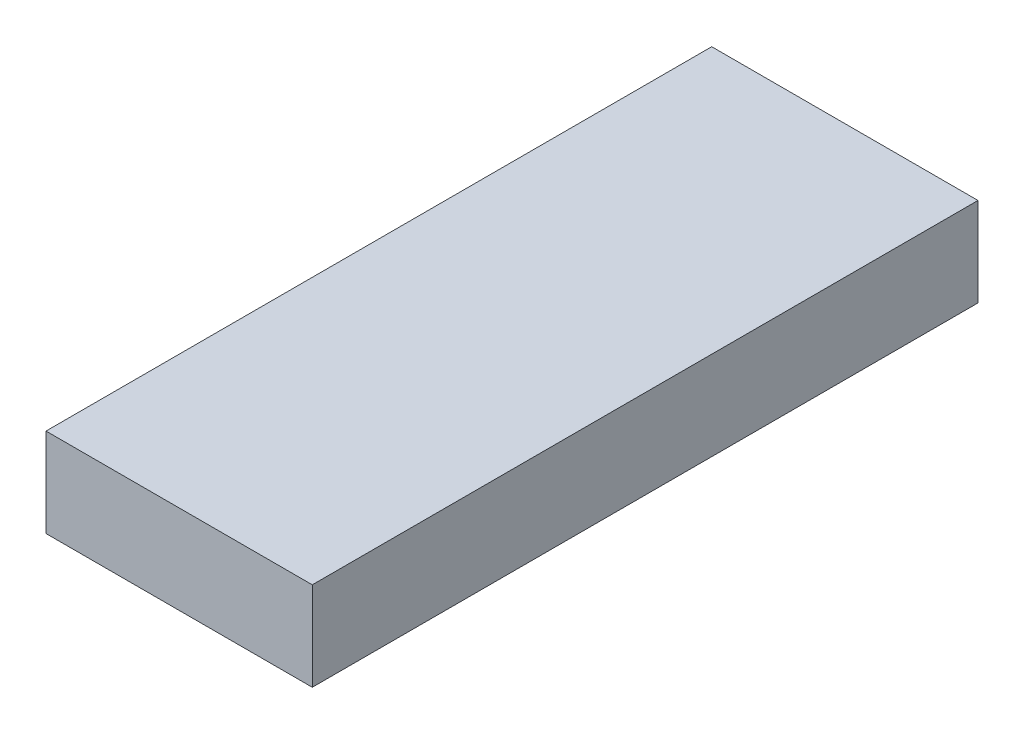
from build123d import *

# Parameters (mm, degrees)
SKETCH_1_W      = 2.6
SKETCH_1_H      = 9.6
EXTRUDE_1_DEPTH = 1.3
EXTRUDE_START   = 1.3
SKETCH_1_3_W    = 6
SKETCH_1_3_H    = 15
SKETCH_1_3_W_2  = 2.6
SKETCH_1_3_H_2  = 9.6
EXTRUDE_2_DEPTH = 2


with BuildPart() as part:
    # 草图1 → 凸台-拉伸1 (new body)
    with BuildSketch(Plane(origin=(0, 0, 0), x_dir=(1, 0, 0), z_dir=(0, 1, 0))):
        Rectangle(SKETCH_1_W, SKETCH_1_H)
    extrude(amount=EXTRUDE_1_DEPTH)

    # 草图1<3> → 凸台-拉伸2 (add)
    # profile 1 of 2: a face of its own
    with BuildSketch(Plane(origin=(0, 0, 0), x_dir=(1, 0, 0), z_dir=(0, 1, 0)).offset(EXTRUDE_START)):
        Rectangle(SKETCH_1_3_W, SKETCH_1_3_H)
        Rectangle(SKETCH_1_3_W_2, SKETCH_1_3_H_2, mode=Mode.SUBTRACT)
    # profile 2 of 2: a face of its own
    with BuildSketch(Plane(origin=(0, 0, 0), x_dir=(1, 0, 0), z_dir=(0, 1, 0)).offset(EXTRUDE_START)):
        Rectangle(SKETCH_1_3_W_2, SKETCH_1_3_H_2)
    extrude(amount=EXTRUDE_2_DEPTH)


solid = part.part
